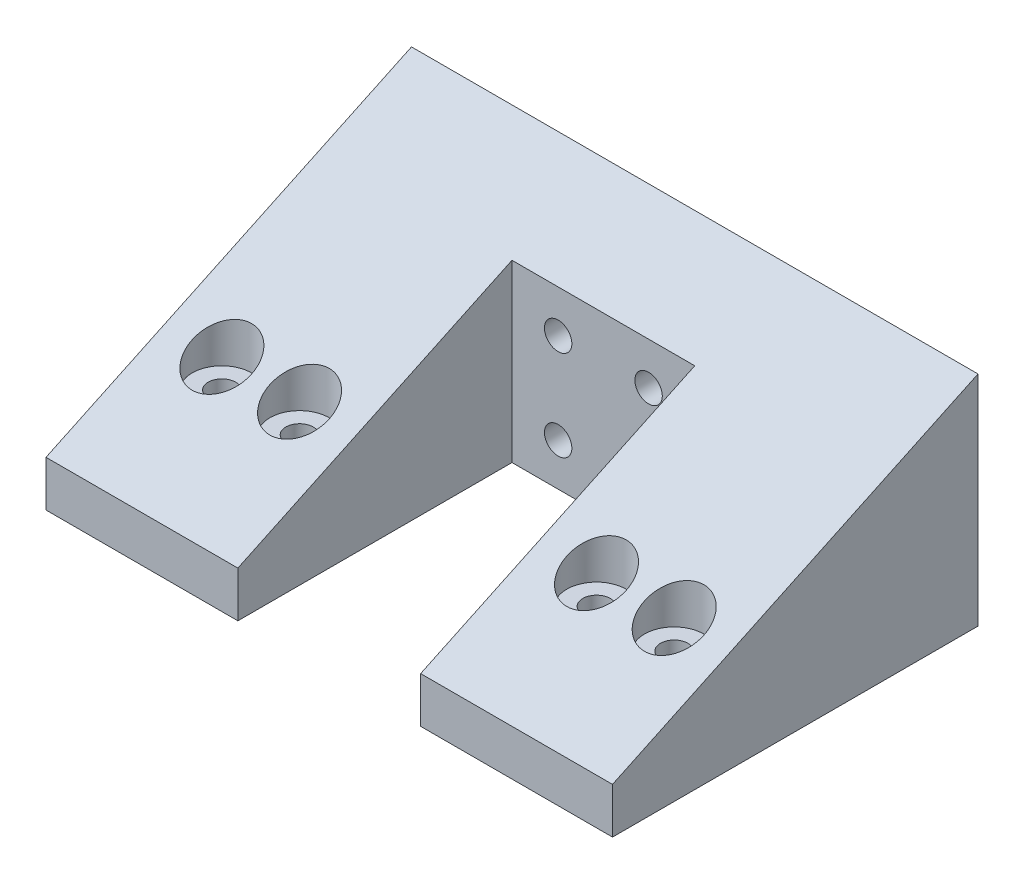
from build123d import *

# Parameters (mm, degrees)
SKETCH1_W      = 62
SKETCH1_H      = 23.9
EXTRUDE1_DEPTH = 40
SKETCH2_W      = 20
SKETCH2_H      = 23.9
EXTRUDE2_DEPTH = 30
EXTRUDE3_DEPTH = 75.744916215
SKETCH4_R      = 1.5
EXTRUDE4_DEPTH = 45.763852605
SKETCH5_R      = 3.25
EXTRUDE5_DEPTH = 15.9
SKETCH6_R      = 1.5
EXTRUDE6_DEPTH = 56.966150484


with BuildPart() as part:
    # Sketch1 → Extrude1 (new body)
    with BuildSketch(Plane.XY):
        Rectangle(SKETCH1_W, SKETCH1_H)
    extrude(amount=EXTRUDE1_DEPTH)

    # Sketch2 → Extrude2 (cut)
    with BuildSketch(Plane.XY.offset(40)):
        Rectangle(SKETCH2_W, SKETCH2_H)
    extrude(amount=-EXTRUDE2_DEPTH, mode=Mode.SUBTRACT)

    # Sketch3 → Extrude3 (cut, through all)
    with BuildSketch(Plane(origin=(31, 0, 0), x_dir=(0, 0, -1), z_dir=(1, 0, 0))):
        Polygon((-40, -6.95), (-40, 11.95), (0, 11.95), align=None)
    extrude(amount=-EXTRUDE3_DEPTH, mode=Mode.SUBTRACT)

    # Sketch4 → Extrude4 (cut, through all)
    with BuildSketch(Plane.XY.offset(10)):
        with Locations((-4.95, 2.5875)):
            Circle(SKETCH4_R)
        with Locations((4.95, 2.5875)):
            Circle(SKETCH4_R)
        with Locations((4.95, -7.3125)):
            Circle(SKETCH4_R)
        with Locations((-4.95, -7.3125)):
            Circle(SKETCH4_R)
    extrude(amount=-EXTRUDE4_DEPTH, mode=Mode.SUBTRACT)

    # Sketch5 → Extrude5 (cut)
    with BuildSketch(Plane(origin=(0, 11.95, 0), x_dir=(1, 0, 0), z_dir=(0, 1, 0))):
        with Locations(Location((-16.25, -27, 0), (0, 0, 270))):
            Circle(SKETCH5_R)
        with Locations(Location((-24.75, -27, 0), (0, 0, 270))):
            Circle(SKETCH5_R)
        with Locations(Location((24.75, -27, 0), (0, 0, 270))):
            Circle(SKETCH5_R)
        with Locations(Location((16.25, -27, 0), (0, 0, 270))):
            Circle(SKETCH5_R)
    extrude(amount=-EXTRUDE5_DEPTH, mode=Mode.SUBTRACT)

    # Sketch6 → Extrude6 (cut, through all)
    with BuildSketch(Plane(origin=(0, 11.95, 0), x_dir=(1, 0, 0), z_dir=(0, 1, 0))):
        with Locations(Location((-24.75, -27, 0), (0, 0, 270))):
            Circle(SKETCH6_R)
        with Locations(Location((-16.25, -27, 0), (0, 0, 270))):
            Circle(SKETCH6_R)
        with Locations(Location((16.25, -27, 0), (0, 0, 270))):
            Circle(SKETCH6_R)
        with Locations(Location((24.75, -27, 0), (0, 0, 270))):
            Circle(SKETCH6_R)
    extrude(amount=-EXTRUDE6_DEPTH, mode=Mode.SUBTRACT)


solid = part.part
